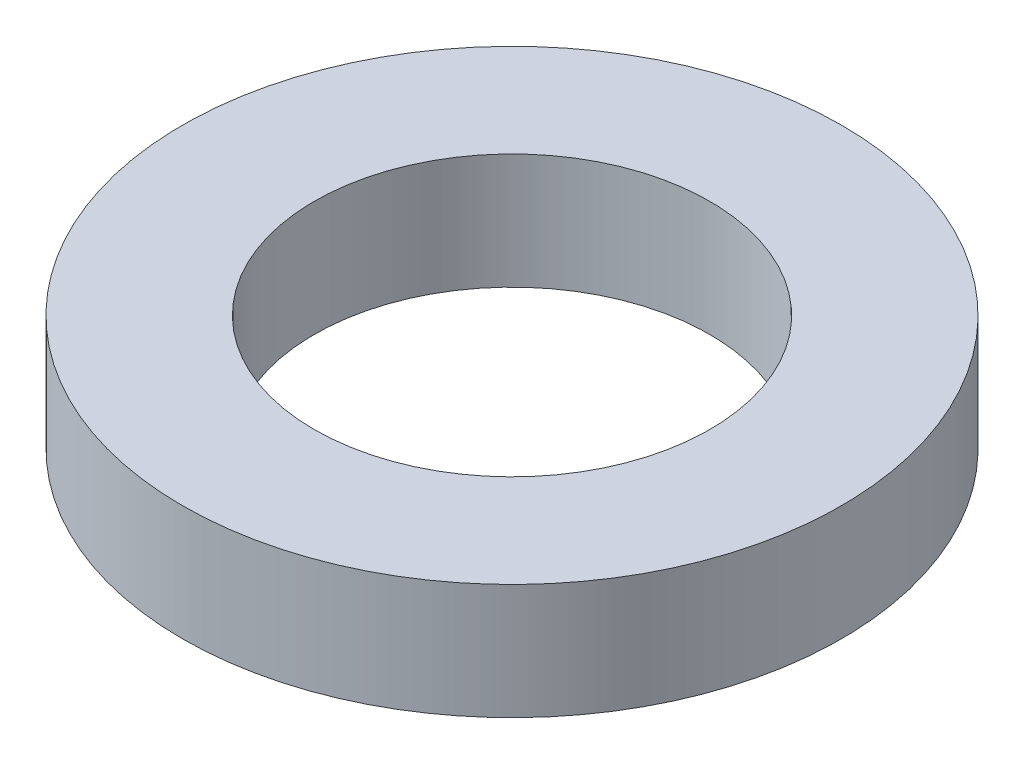
from build123d import *

# Parameters (mm, degrees)
SKETCH1_R           = 10
SKETCH1_R_2         = 6
BOSS_EXTRUDE1_DEPTH = 3.5


with BuildPart() as part:
    # Sketch1 → Boss-Extrude1 (new body)
    with BuildSketch(Plane(origin=(0, 0, 0), x_dir=(1, 0, 0), z_dir=(0, 1, 0))):
        with Locations(Location((0, 0, 0), (0, 0, 270))):
            Circle(SKETCH1_R)
        with Locations(Location((0, 0, 0), (0, 0, 270))):
            Circle(SKETCH1_R_2, mode=Mode.SUBTRACT)
    extrude(amount=BOSS_EXTRUDE1_DEPTH)


solid = part.part
